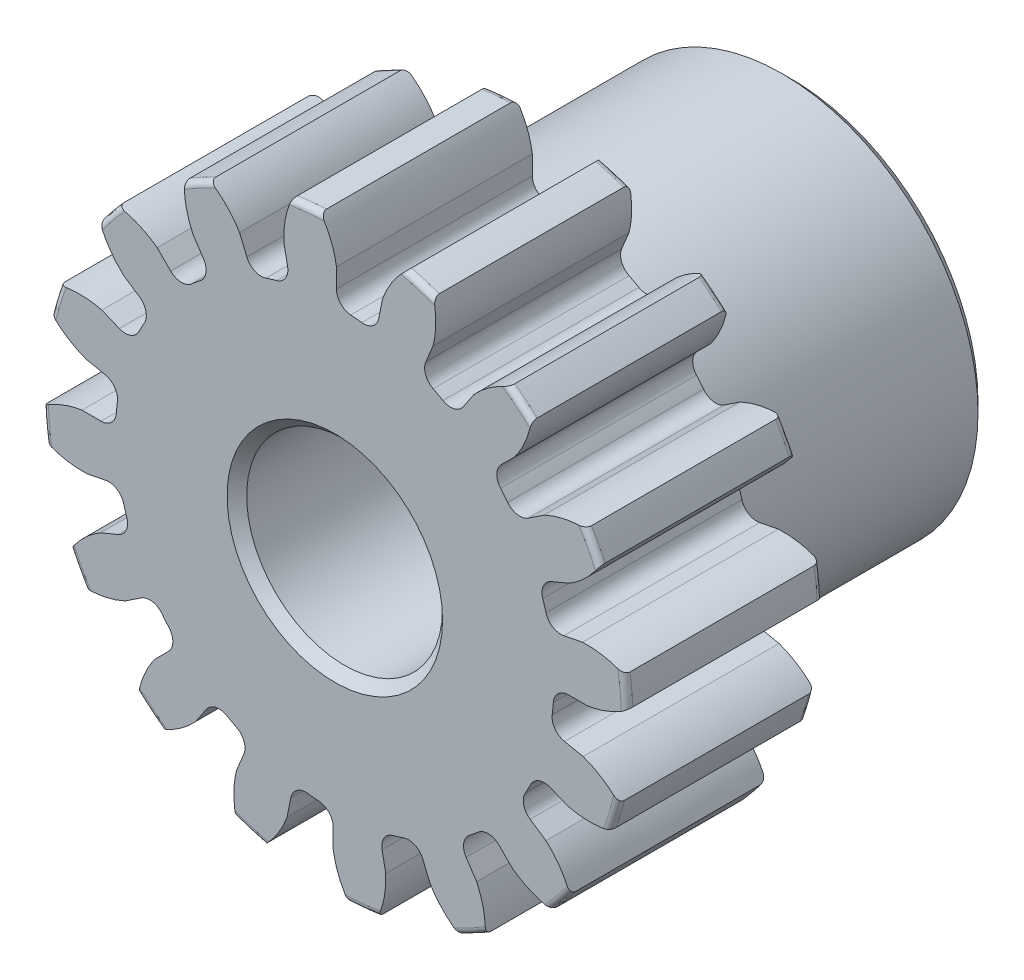
from build123d import *

# Parameters (mm, degrees)
SKETCH1_R                = 7.112
BOSS_EXTRUDE1_DEPTH      = 4.7625
SKETCH2_W                = 6.35
SKETCH2_H                = 4.7625
FILLET2_R                = 0.14224
CUT_EXTRUDE1_DEPTH       = 15.988286902
FILLET1_R                = 0.37404675
CIRPATTERN1_COUNT        = 16
FILLET1_OF_CIRPATTERN1_R = 0.37404675
SKETCH5_R                = 2.38125
CUT_EXTRUDE2_DEPTH       = 15.98034754
CHAMFER1_SIZE            = 0.238125


with BuildPart() as part:
    # Sketch1 → Boss-Extrude1 (new body)
    with BuildSketch(Plane.XY):
        Circle(SKETCH1_R)
    extrude(amount=-BOSS_EXTRUDE1_DEPTH)

    # Sketch2 → Revolve1 (revolve)
    with BuildSketch(Plane(origin=(0, 0, 0), x_dir=(0, 0, -1), z_dir=(1, 0, 0)), mode=Mode.PRIVATE) as revolve1_sk:
        with Locations((7.9375, 2.38125)):
            Rectangle(SKETCH2_W, SKETCH2_H)
    revolve(revolve1_sk.sketch.rotate(Axis((0, 0, -4.7625), (0, 0, -1)), 90), axis=Axis((0, 0, -4.7625), (0, 0, -1)))

    # Fillet2
    fillet2_edges = [part.edges().sort_by_distance(p)[0] for p in [
        (-7.112, 0, 0),
        (-7.112, 0, -4.7625),
        (-4.7625, 0, -4.7625),
    ]]
    fillet(fillet2_edges, radius=FILLET2_R)

    # Sketch4 → Cut-Extrude1 (cut, through all)
    with BuildSketch(Plane.XY):
        with BuildLine():
            Line((0.039756598, 6.147608965), (0.039756598, 5.325914116))
            ThreePointArc((0.039756598, 5.325914116), (0.522046632, 5.300415933), (1.000044016, 5.231333838))
            Line((1.000044016, 5.231333838), (1.160349098, 6.037239977))
            add(Edge.make_bspline(
                [(2.084637688, 7.187445149), (1.4115305, 6.736849805), (1.160349098, 6.037239977)],
                knots=[0, 0, 0, 1, 1, 1], degree=2))
            ThreePointArc((2.084637688, 7.187445149), (0.733528106, 7.447618316), (-0.642377547, 7.456033339))
            add(Edge.make_bspline(
                [(-0.642377547, 7.456033339), (-0.070110979, 6.882779097), (0.039756598, 6.147608965)],
                knots=[0, 0, 0, 1, 1, 1], degree=2))
        make_face()
    cut_extrude1 = extrude(amount=-CUT_EXTRUDE1_DEPTH, mode=Mode.SUBTRACT)

    # Fillet1
    fillet1_edges = [part.edges().sort_by_distance(p)[0] for p in [
        (1.000044016, 5.231333838, -2.38125),
        (0.039756598, 5.325914116, -2.38125),
    ]]
    fillet(fillet1_edges, radius=FILLET1_R)

    # CirPattern1: Cut-Extrude1 ×16 about axis
    cirpattern1_axis = Axis((0, 0, -4.7625), (0, 0, 1))
    for i in range(1, CIRPATTERN1_COUNT):
        add(cut_extrude1.rotate(cirpattern1_axis, i * 360 / CIRPATTERN1_COUNT), mode=Mode.SUBTRACT)

    # Fillet1 of CirPattern1
    fillet1_of_cirpattern1_edges = [part.edges().sort_by_distance(p)[0] for p in [
        (-1.078024591, 5.215822537, -2.38125),
        (-2.001408787, 4.935717235, -2.38125),
        (-2.991973726, 4.406249536, -2.38125),
        (-3.737877827, 3.794102147, -2.38125),
        (-4.450421984, 2.925864986, -2.38125),
        (-4.905288852, 2.074869402, -2.38125),
        (-5.231333838, 1.000044016, -2.38125),
        (-5.325914116, 0.039756598, -2.38125),
        (-5.215822537, -1.078024591, -2.38125),
        (-4.935717235, -2.001408787, -2.38125),
        (-4.406249536, -2.991973726, -2.38125),
        (-3.794102147, -3.737877827, -2.38125),
        (-2.925864986, -4.450421984, -2.38125),
        (-2.074869402, -4.905288852, -2.38125),
        (-1.000044016, -5.231333838, -2.38125),
        (-0.039756598, -5.325914116, -2.38125),
        (1.078024591, -5.215822537, -2.38125),
        (2.001408787, -4.935717235, -2.38125),
        (2.991973726, -4.406249536, -2.38125),
        (3.737877827, -3.794102147, -2.38125),
        (4.450421984, -2.925864986, -2.38125),
        (4.905288852, -2.074869402, -2.38125),
        (5.231333838, -1.000044016, -2.38125),
        (5.325914116, -0.039756598, -2.38125),
        (5.215822537, 1.078024591, -2.38125),
        (4.935717235, 2.001408787, -2.38125),
        (4.406249536, 2.991973726, -2.38125),
        (3.794102147, 3.737877827, -2.38125),
        (2.925864986, 4.450421984, -2.38125),
        (2.074869402, 4.905288852, -2.38125),
    ]]
    fillet(fillet1_of_cirpattern1_edges, radius=FILLET1_OF_CIRPATTERN1_R)

    # Sketch5 → Cut-Extrude2 (cut, through all)
    with BuildSketch(Plane.XY):
        Circle(SKETCH5_R)
    extrude(amount=-CUT_EXTRUDE2_DEPTH, mode=Mode.SUBTRACT)

    # Chamfer1
    chamfer1_edges = [part.edges().sort_by_distance(p)[0] for p in [
        (-4.7625, 0, -11.1125),
        (-2.38125, 0, -11.1125),
        (-2.38125, 0, 0),
    ]]
    chamfer(chamfer1_edges, length=CHAMFER1_SIZE)


solid = part.part
